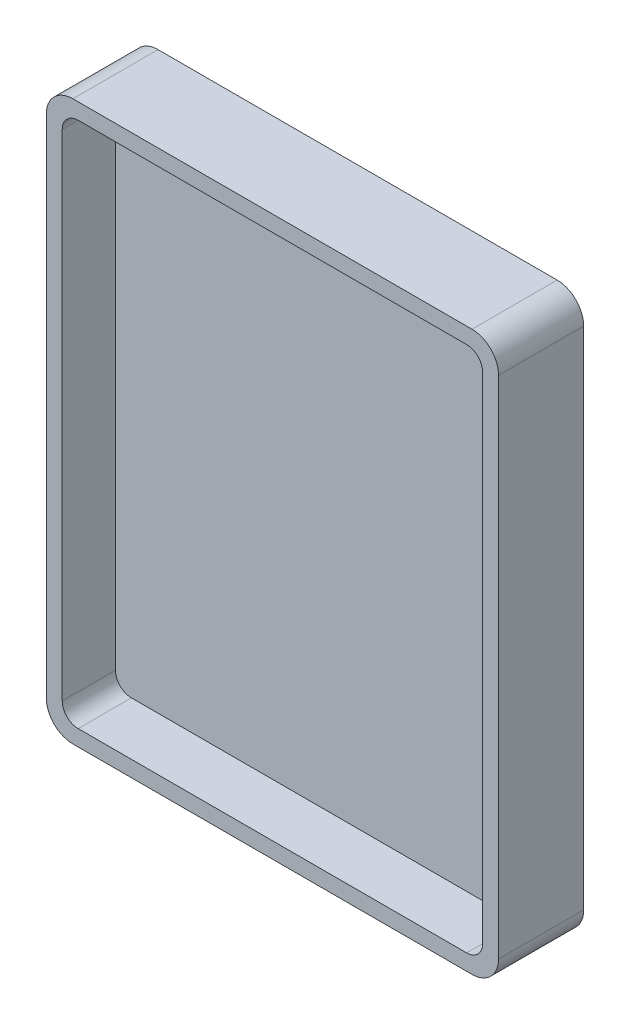
from build123d import *

# Parameters (mm, degrees)
SKETCH1_W           = 85
SKETCH1_H           = 105
BOSS_EXTRUDE1_DEPTH = 16
SKETCH2_W           = 79
SKETCH2_H           = 99
CUT_EXTRUDE1_DEPTH  = 10
FILLET1_R           = 5
SKETCH3_R           = 2
CUT_EXTRUDE2_DEPTH  = 1.5
SKETCH4_R           = 1.35
CUT_EXTRUDE3_DEPTH  = 87.372738755
FILLET2_R           = 3


with BuildPart() as part:
    # Sketch1 → Boss-Extrude1 (new body)
    with BuildSketch(Plane.XY):
        with Locations((-12.5, 12.5)):
            Rectangle(SKETCH1_W, SKETCH1_H)
    extrude(amount=BOSS_EXTRUDE1_DEPTH)

    # Sketch2 → Cut-Extrude1 (cut)
    with BuildSketch(Plane.XY.offset(16)):
        with Locations((-12.5, 12.5)):
            Rectangle(SKETCH2_W, SKETCH2_H)
    extrude(amount=-CUT_EXTRUDE1_DEPTH, mode=Mode.SUBTRACT)

    # Fillet1
    fillet1_edges = [part.edges().sort_by_distance(p)[0] for p in [
        (-55, 65, 8),
        (30, 65, 8),
        (30, -40, 8),
        (-55, -40, 8),
    ]]
    fillet(fillet1_edges, radius=FILLET1_R)

    # Sketch3 → Cut-Extrude2 (cut)
    with BuildSketch(Plane(origin=(0, 0, 0), x_dir=(-1, 0, 0), z_dir=(0, 0, -1))):
        with Locations((48.5, 58.5)):
            Circle(SKETCH3_R)
        with Locations((-23.5, -33.5)):
            Circle(SKETCH3_R)
    extrude(amount=-CUT_EXTRUDE2_DEPTH, mode=Mode.SUBTRACT)

    # Sketch4 → Cut-Extrude3 (cut, through all)
    with BuildSketch(Plane(origin=(0, 0, 1.5), x_dir=(-1, 0, 0), z_dir=(0, 0, -1))):
        with Locations((48.5, 58.5)):
            Circle(SKETCH4_R)
        with Locations((-23.5, -33.5)):
            Circle(SKETCH4_R)
    extrude(amount=-CUT_EXTRUDE3_DEPTH, mode=Mode.SUBTRACT)

    # Fillet2
    fillet2_edges = [part.edges().sort_by_distance(p)[0] for p in [
        (-52, -37, 11),
        (-52, 62, 11),
        (27, 62, 11),
        (27, -37, 11),
    ]]
    fillet(fillet2_edges, radius=FILLET2_R)


solid = part.part
